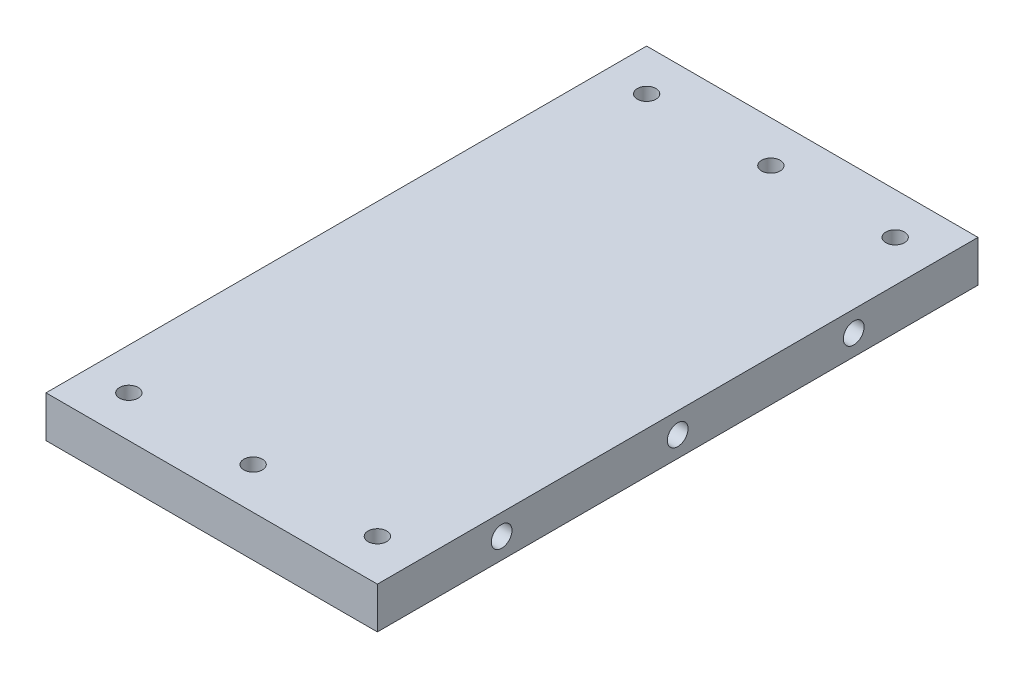
from build123d import *

# Parameters (mm, degrees)
CROQUIS1_W              = 80
CROQUIS1_H              = 145
SALIENTE_EXTRUIR1_DEPTH = 5
CROQUIS2_R              = 2.5
CORTAR_EXTRUIR1_DEPTH   = 10
CROQUIS3_R              = 2.25
CORTAR_EXTRUIR2_DEPTH   = 84.404136588


with BuildPart() as part:
    # Croquis1 → Saliente-Extruir1 (new, symmetric)
    with BuildSketch(Plane(origin=(0, 0, 0), x_dir=(1, 0, 0), z_dir=(0, 1, 0))):
        Rectangle(CROQUIS1_W, CROQUIS1_H)
    extrude(amount=SALIENTE_EXTRUIR1_DEPTH, both=True)

    # Croquis2 → Cortar-Extruir1 (cut)
    with BuildSketch(Plane(origin=(40, 0, 0), x_dir=(0, 0, -1), z_dir=(1, 0, 0))):
        Circle(CROQUIS2_R)
        with Locations((42.5, 0)):
            Circle(CROQUIS2_R)
        with Locations((-42.5, 0)):
            Circle(CROQUIS2_R)
    cortar_extruir1 = extrude(amount=-CORTAR_EXTRUIR1_DEPTH, mode=Mode.SUBTRACT)

    # Simetría1: Cortar-Extruir1 across plane
    add(cortar_extruir1.mirror(Plane(origin=(0, 0, 0), x_dir=(0, 0, 1), z_dir=(1, 0, 0))), mode=Mode.SUBTRACT)

    # Croquis3 → Cortar-Extruir2 (cut, through all)
    with BuildSketch(Plane.XZ.offset(5)):
        with Locations(Location((-30, 62.5, 0), (0, 0, 270))):
            Circle(CROQUIS3_R)
        with Locations(Location((0, 62.5, 0), (0, 0, 270))):
            Circle(CROQUIS3_R)
        with Locations(Location((30, 62.5, 0), (0, 0, 270))):
            Circle(CROQUIS3_R)
        with Locations(Location((30, -62.5, 0), (0, 0, 90))):
            Circle(CROQUIS3_R)
        with Locations(Location((0, -62.5, 0), (0, 0, 90))):
            Circle(CROQUIS3_R)
        with Locations(Location((-30, -62.5, 0), (0, 0, 90))):
            Circle(CROQUIS3_R)
    extrude(amount=-CORTAR_EXTRUIR2_DEPTH, mode=Mode.SUBTRACT)


solid = part.part
